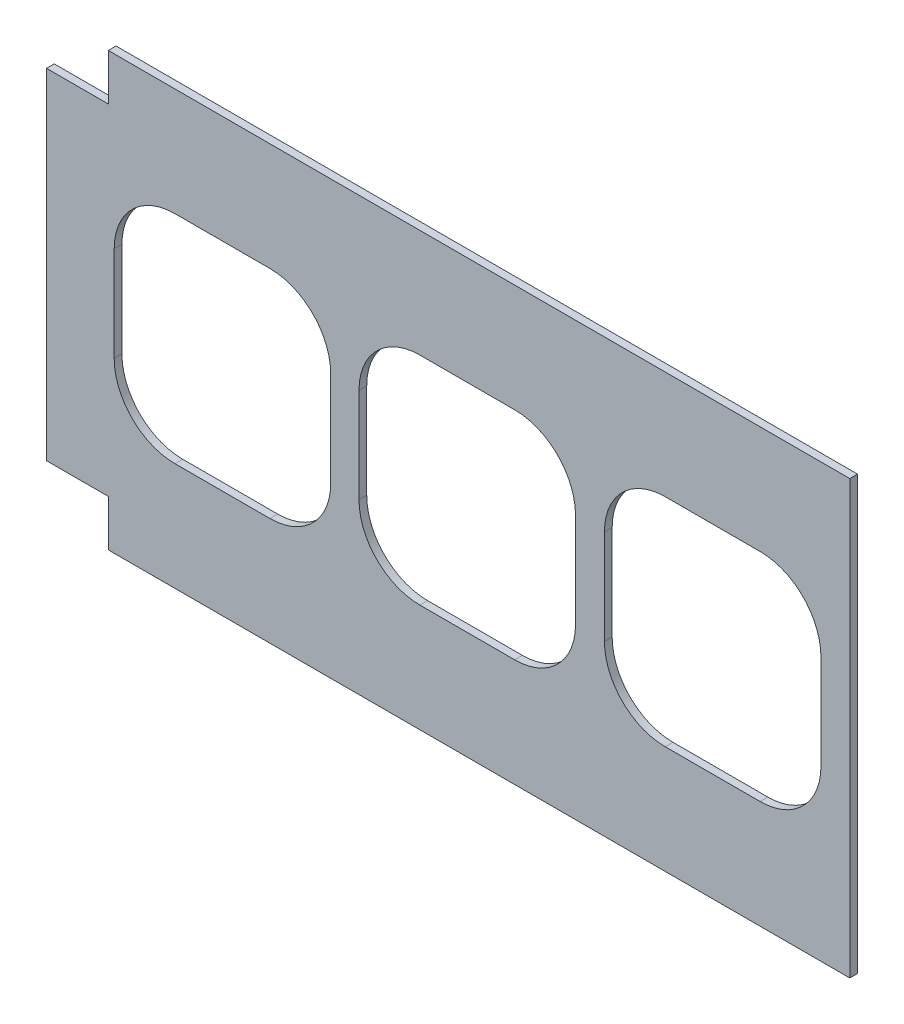
from build123d import *

# Parameters (mm, degrees)
SKETCH1_W           = 89
SKETCH1_H           = 89
BOSS_EXTRUDE1_DEPTH = 3.175
FILLET1_R           = 25


with BuildPart() as part:
    # Sketch1 → Boss-Extrude1 (new body)
    with BuildSketch(Plane.XY):
        Polygon((-152.4, 69.85), (-177.8, 69.85), (-177.8, -69.85), (-152.4, -69.85), (-152.4, -88.9), (152.4, -88.9), (152.4, 88.9), (-152.4, 88.9), align=None)
        with Locations((96.05, 0)):
            Rectangle(SKETCH1_W, SKETCH1_H, mode=Mode.SUBTRACT)
        with Locations((-105.474, 0)):
            Rectangle(SKETCH1_W, SKETCH1_H, mode=Mode.SUBTRACT)
        with Locations((-4.839, 0)):
            Rectangle(SKETCH1_W, SKETCH1_H, mode=Mode.SUBTRACT)
    extrude(amount=BOSS_EXTRUDE1_DEPTH)

    # Fillet1
    fillet1_edges = [part.edges().sort_by_distance(p)[0] for p in [
        (140.55, -44.5, 1.5875),
        (140.55, 44.5, 1.5875),
        (51.55, 44.5, 1.5875),
        (51.55, -44.5, 1.5875),
        (-149.974, 44.5, 1.5875),
        (-149.974, -44.5, 1.5875),
        (-60.974, -44.5, 1.5875),
        (-60.974, 44.5, 1.5875),
        (-49.339, 44.5, 1.5875),
        (-49.339, -44.5, 1.5875),
        (39.661, -44.5, 1.5875),
        (39.661, 44.5, 1.5875),
    ]]
    fillet(fillet1_edges, radius=FILLET1_R)


solid = part.part
